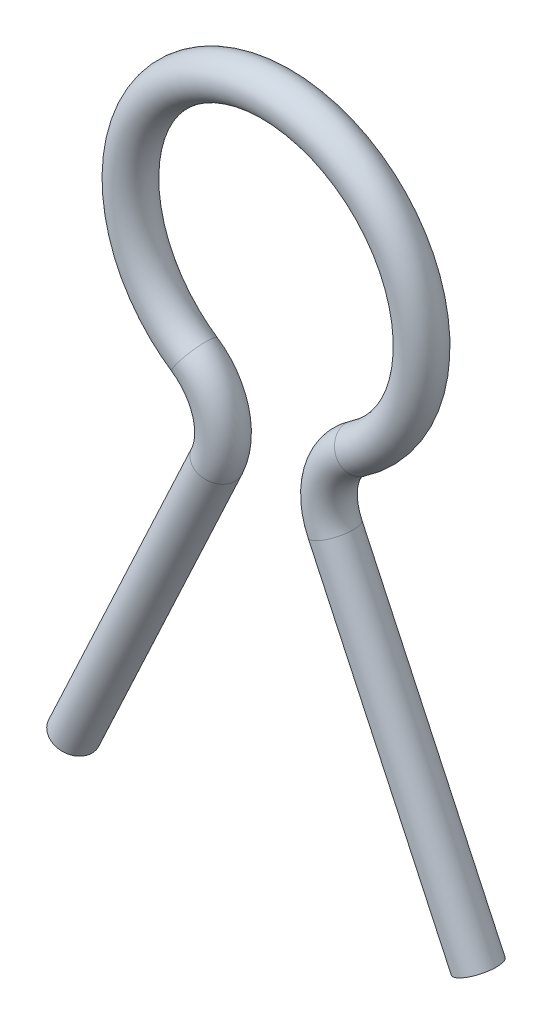
from build123d import *

# Parameters (mm, degrees)
SKETCH3_R = 0.7874


with BuildPart() as part:
    # Sweep1: sweep along a path in Sketch1
    with BuildLine(Plane.XY) as sweep1_path:
        Line((0, 0), (-5.620726606, 12.053687105))
        ThreePointArc((-5.620726606, 12.053687105), (-5.766457952, 13.805447622), (-4.739872572, 15.232341099))
        ThreePointArc((-4.739872572, 15.232341099), (-7.9375, 25.684049221), (-11.135127428, 15.232341099))
        ThreePointArc((-11.135127428, 15.232341099), (-10.108542048, 13.805447622), (-10.254273394, 12.053687105))
        Line((-10.254273394, 12.053687105), (-15.875, 0))
    # Sketch3 → Sweep1 (sweep)
    with BuildSketch(Plane(origin=(0, 0, 0), x_dir=(0.9063077870366525, 0.422618261740694, 0), z_dir=(-0.422618261740694, 0.9063077870366525, 0))):
        Circle(SKETCH3_R)
    sweep(path=sweep1_path.line)


solid = part.part
